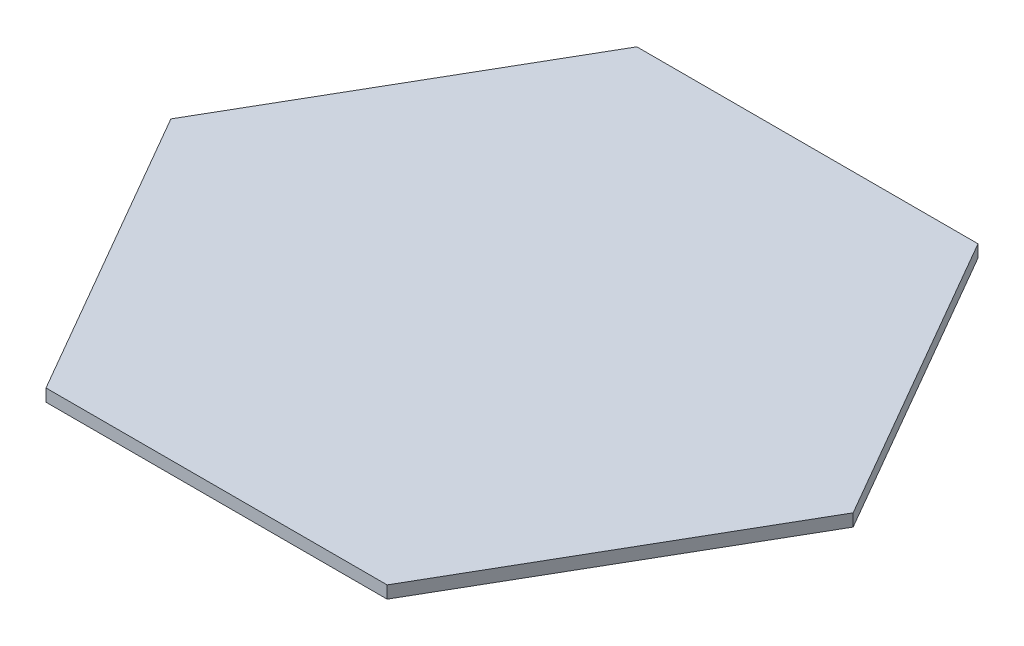
from build123d import *

# Parameters (mm, degrees)
BOSS_EXTRUDE1_DEPTH = 5


with BuildPart() as part:
    # Sketch1 → Boss-Extrude1 (new body)
    with BuildSketch(Plane(origin=(0, 0, 0), x_dir=(1, 0, 0), z_dir=(0, 1, 0))):
        Polygon((137.886751346, 0), (68.943375673, 119.413429511), (-68.943375673, 119.413429511), (-137.886751346, 0), (-68.943375673, -119.413429511), (68.943375673, -119.413429511), align=None)
    extrude(amount=BOSS_EXTRUDE1_DEPTH)


solid = part.part
